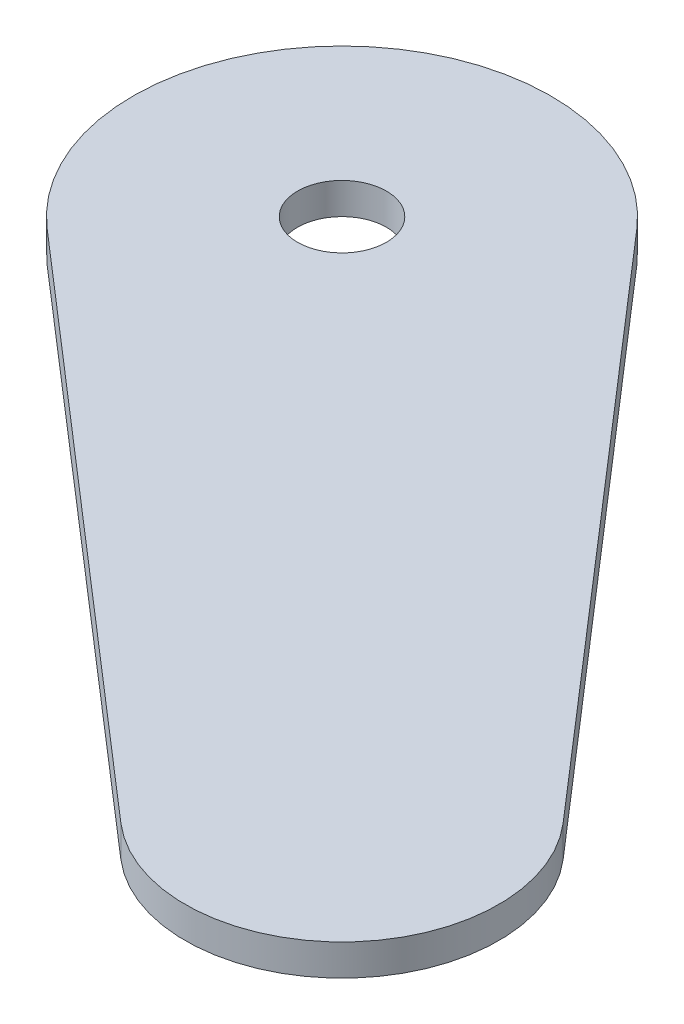
from build123d import *

# Parameters (mm, degrees)
SKETCH_1_R          = 20
SKETCH_1_R_2        = 15
EXTRUDE_1_DEPTH     = 3
SKETCH_2_R          = 2.5
CUT_EXTRUDE_1_DEPTH = 92.262525064
SKETCH_3_R          = 5
CUT_EXTRUDE_2_DEPTH = 10
SKETCH_4_R          = 5
SKETCH_4_R_2        = 4.25
EXTRUDE_2_DEPTH     = 3


with BuildPart() as part:
    # 草图1 → 凸台-拉伸1 (new body)
    with BuildSketch(Plane(origin=(0, 0, 0), x_dir=(1, 0, 0), z_dir=(0, 1, 0))):
        Circle(SKETCH_1_R)
        with BuildLine():
            ThreePointArc((20, 0), (8.309115435, -18.192267607), (-13.095860068, -15.116165158))
            Line((-13.095860068, -15.116165158), (39.675579632, -60.834598551))
            ThreePointArc((39.675579632, -60.834598551), (38.890872965, -38.890872965), (60.834598551, -39.675579632))
            Line((60.834598551, -39.675579632), (15.116165158, 13.095860068))
            ThreePointArc((15.116165158, 13.095860068), (18.73930766, 6.98844392), (20, 0))
        make_face()
        with Locations((49.497474683, -49.497474683)):
            Circle(SKETCH_1_R_2)
    extrude(amount=EXTRUDE_1_DEPTH)

    # 草图2 → 切除-拉伸1 (cut, through all)
    with BuildSketch(Plane(origin=(0, 3, 0), x_dir=(1, 0, 0), z_dir=(0, 1, 0))):
        with Locations(Location((0, 0, 0), (0, 0, 270))):
            Circle(SKETCH_2_R)
    extrude(amount=-CUT_EXTRUDE_1_DEPTH, mode=Mode.SUBTRACT)

    # 草图3 → 切除-拉伸2 (cut)
    with BuildSketch(Plane(origin=(0, 3, 0), x_dir=(1, 0, 0), z_dir=(0, 1, 0))):
        with Locations(Location((0, 0, 0), (0, 0, 270))):
            Circle(SKETCH_3_R)
    extrude(amount=-CUT_EXTRUDE_2_DEPTH, mode=Mode.SUBTRACT)

    # 草图4 → 凸台-拉伸2 (add)
    with BuildSketch(Plane(origin=(0, 3, 0), x_dir=(1, 0, 0), z_dir=(0, 1, 0))):
        Circle(SKETCH_4_R)
        with Locations(Location((0, 0, 0), (0, 0, 270))):
            Circle(SKETCH_4_R_2, mode=Mode.SUBTRACT)
    extrude(amount=-EXTRUDE_2_DEPTH)


solid = part.part
